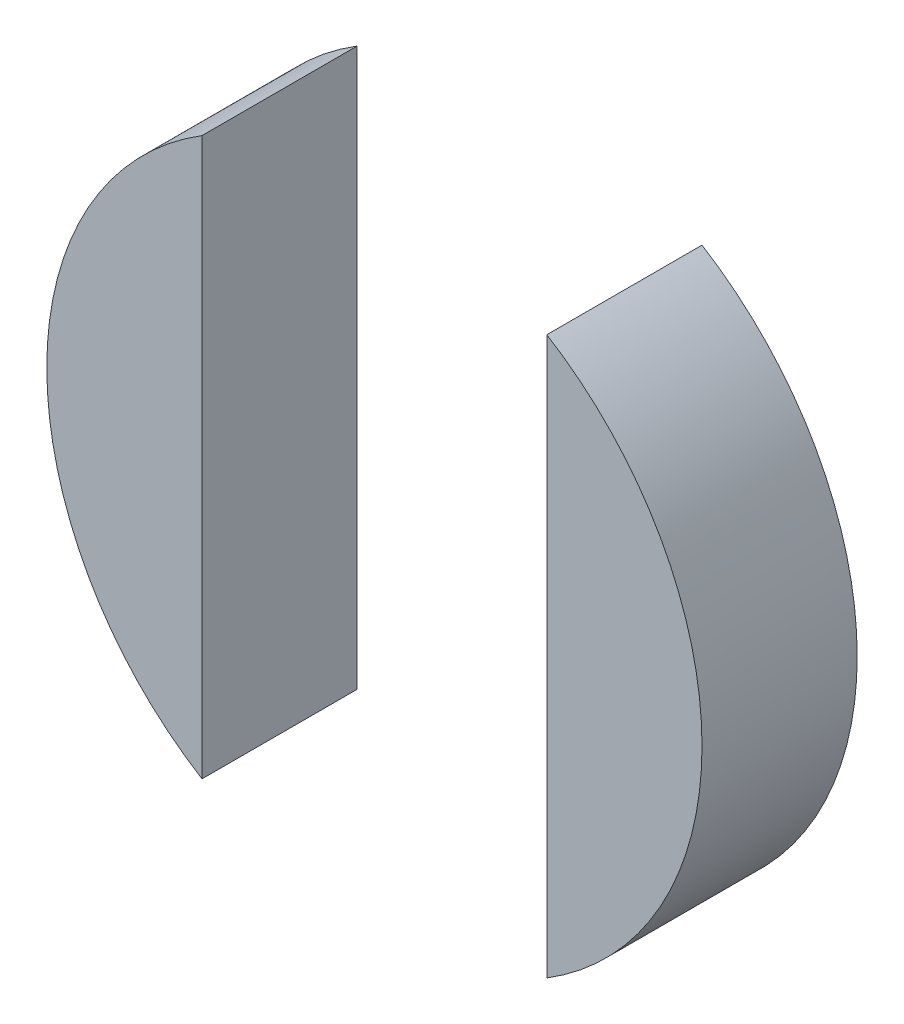
from build123d import *

# Parameters (mm, degrees)
BOSS_EXTRUDE1_DEPTH   = 4.5
BOSS_EXTRUDE1_2_DEPTH = 4.5


with BuildPart() as part:
    # Sketch1 → Boss-Extrude1 (new body)
    with BuildSketch(Plane.XY):
        with BuildLine():
            Line((-5, 8.077747211), (-5, -8.077747211))
            ThreePointArc((-5, -8.077747211), (-9.5, 0), (-5, 8.077747211))
        make_face()
    extrude(amount=BOSS_EXTRUDE1_DEPTH)


with BuildPart() as body_2:
    # Sketch1 → Boss-Extrude1 2 (new body)
    with BuildSketch(Plane.XY):
        with BuildLine():
            Line((5, 8.077747211), (5, -8.077747211))
            ThreePointArc((5, -8.077747211), (9.5, 0), (5, 8.077747211))
        make_face()
    extrude(amount=BOSS_EXTRUDE1_2_DEPTH)


solid = Compound([part.part, body_2.part])
